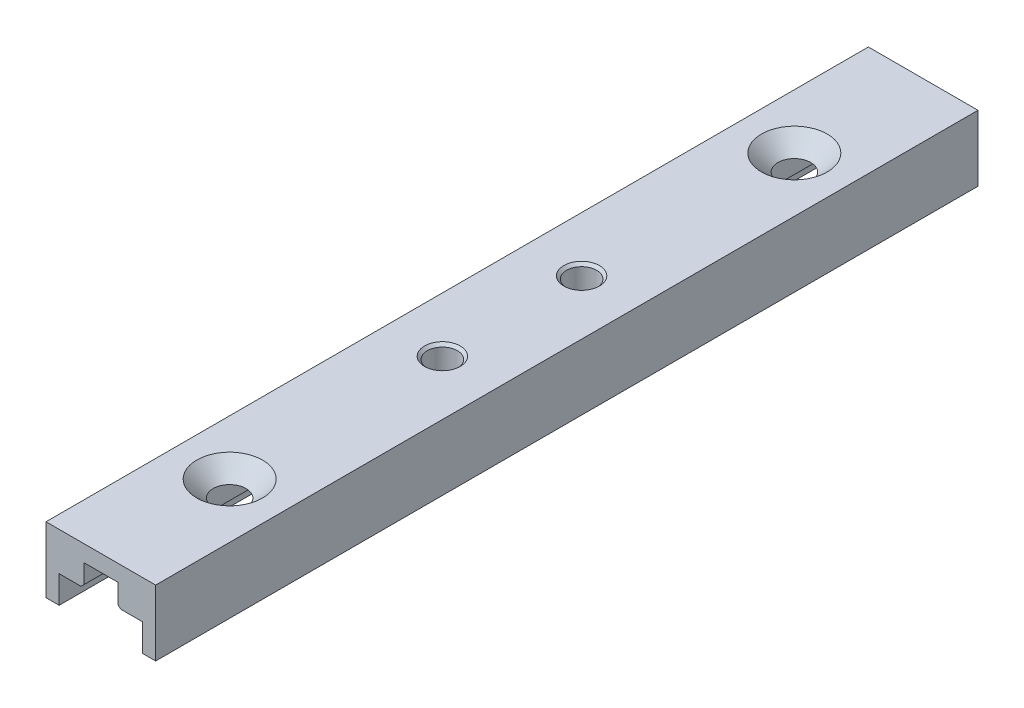
from build123d import *

# Parameters (mm, degrees)
BOSS_EXTRUDE1_DEPTH      = 75
BOSS_EXTRUDE1_DEPTH_BACK = 75
CUT_EXTRUDE1_REACH       = 78.609
SKETCH2_R                = 2.5
SKETCH2_R_2              = 2.75
CHAMFER1_SIZE            = 3.5
SKETCH3_W                = 6.2
SKETCH3_H                = 4
CUT_EXTRUDE2_DEPTH       = 35
CHAMFER3_SIZE            = 0.5
FILLET1_R                = 1
CHAMFER2_SIZE            = 0.5


with BuildPart() as part:
    # Sketch1 → Boss-Extrude1 (new, two sides: drawn at the far end of the back side and taken through both)
    with BuildSketch(Plane.XY.offset(-BOSS_EXTRUDE1_DEPTH_BACK)):
        Polygon((0, 0), (7.6, 0), (7.6, -5), (10, -5), (10, 7), (-10, 7), (-10, -5), (-7.6, -5), (-7.6, 0), align=None)
    extrude(amount=BOSS_EXTRUDE1_DEPTH + BOSS_EXTRUDE1_DEPTH_BACK)

    # Sketch2 → Cut-Extrude1 (cut, up to next)
    with BuildSketch(Plane(origin=(0, 7, 0), x_dir=(1, 0, 0), z_dir=(0, 1, 0)), mode=Mode.PRIVATE) as cut_extrude1_sk1:
        with Locations((0, -51.5)):
            Circle(SKETCH2_R)
    cut_extrude1_tool1 = extrude(cut_extrude1_sk1.sketch, amount=-CUT_EXTRUDE1_REACH, mode=Mode.PRIVATE) & part.part
    # Sketch2 → Cut-Extrude1 (cut, up to next)
    with BuildSketch(Plane(origin=(0, 7, 0), x_dir=(1, 0, 0), z_dir=(0, 1, 0)), mode=Mode.PRIVATE) as cut_extrude1_sk2:
        with Locations((0, 12.7)):
            Circle(SKETCH2_R_2)
    cut_extrude1_tool2 = extrude(cut_extrude1_sk2.sketch, amount=-CUT_EXTRUDE1_REACH, mode=Mode.PRIVATE) & part.part
    # Sketch2 → Cut-Extrude1 (cut, up to next)
    with BuildSketch(Plane(origin=(0, 7, 0), x_dir=(1, 0, 0), z_dir=(0, 1, 0)), mode=Mode.PRIVATE) as cut_extrude1_sk3:
        with Locations((0, -12.7)):
            Circle(SKETCH2_R_2)
    cut_extrude1_tool3 = extrude(cut_extrude1_sk3.sketch, amount=-CUT_EXTRUDE1_REACH, mode=Mode.PRIVATE) & part.part
    # Sketch2 → Cut-Extrude1 (cut, up to next)
    with BuildSketch(Plane(origin=(0, 7, 0), x_dir=(1, 0, 0), z_dir=(0, 1, 0)), mode=Mode.PRIVATE) as cut_extrude1_sk4:
        with Locations((0, 51.5)):
            Circle(SKETCH2_R)
    cut_extrude1_tool4 = extrude(cut_extrude1_sk4.sketch, amount=-CUT_EXTRUDE1_REACH, mode=Mode.PRIVATE) & part.part
    add(cut_extrude1_tool1.solids().sort_by_distance((0, 7, 51.5))[0], mode=Mode.SUBTRACT)
    add(cut_extrude1_tool2.solids().sort_by_distance((0, 7, -12.7))[0], mode=Mode.SUBTRACT)
    add(cut_extrude1_tool3.solids().sort_by_distance((0, 7, 12.7))[0], mode=Mode.SUBTRACT)
    add(cut_extrude1_tool4.solids().sort_by_distance((0, 7, -51.5))[0], mode=Mode.SUBTRACT)

    # Chamfer1
    chamfer1_edges = [part.edges().sort_by_distance(p)[0] for p in [
        (-2.5, 7, 51.5),
        (-2.5, 7, -51.5),
    ]]
    chamfer(chamfer1_edges, length=CHAMFER1_SIZE)

    # Sketch3 → Cut-Extrude2 (cut)
    with BuildSketch(Plane.XY.offset(75)):
        with Locations((0, 2)):
            Rectangle(SKETCH3_W, SKETCH3_H)
    cut_extrude2 = extrude(amount=-CUT_EXTRUDE2_DEPTH, mode=Mode.SUBTRACT)

    # Mirror2: Cut-Extrude2 across plane
    add(cut_extrude2.mirror(Plane.XY), mode=Mode.SUBTRACT)

    # Chamfer3
    chamfer3_edges = [part.edges().sort_by_distance(p)[0] for p in [
        (-2.75, 7, -12.7),
        (-2.75, 7, 12.7),
        (-2.75, 0, -12.7),
        (-2.75, 0, 12.7),
    ]]
    chamfer(chamfer3_edges, length=CHAMFER3_SIZE)

    # Fillet1
    fillet1_edges = [part.edges().sort_by_distance(p)[0] for p in [
        (-3.1, 2, -40),
        (3.1, 2, -40),
        (-3.1, 2, 40),
        (3.1, 2, 40),
    ]]
    fillet(fillet1_edges, radius=FILLET1_R)

    # Chamfer2
    chamfer2_edges = [part.edges().sort_by_distance(p)[0] for p in [
        (-3.1, 0, 58),
        (0, 0, 40),
        (3.1, 0, 58),
        (-3.1, 0, -58),
        (0, 0, -40),
        (3.1, 0, -58),
        (-2.807106781, 0, -40.292893219),
        (2.807106781, 0, -40.292893219),
        (-2.807106781, 0, 40.292893219),
        (2.807106781, 0, 40.292893219),
    ]]
    chamfer(chamfer2_edges, length=CHAMFER2_SIZE)


solid = part.part
